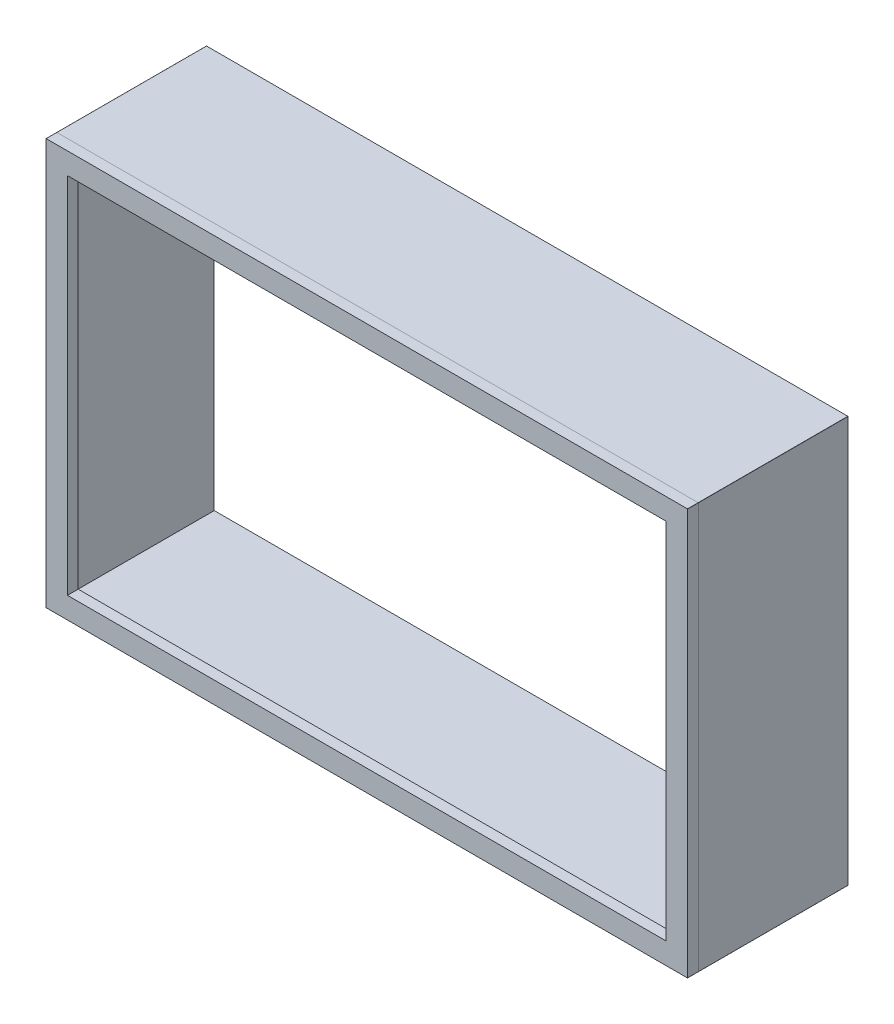
from build123d import *

# Parameters (mm, degrees)
EXTRUDE_THIN1_DEPTH      = 203.2
EXTRUDE_THIN1_DEPTH_BACK = 152.4
SKETCH1_W                = 1486.916
SKETCH1_H                = 928.116
SKETCH2_W                = 1422.4
SKETCH2_H                = 863.6
EXTRUDE_THIN2_DEPTH      = 25.4


with BuildPart() as part:
    # Sketch1 → Extrude-Thin1 (new, two sides: drawn at the far end of the back side and taken through both)
    with BuildSketch(Plane.XY.offset(-EXTRUDE_THIN1_DEPTH_BACK)):
        with BuildLine():
            Line((-761.746, 482.6), (761.746, 482.6))
            ThreePointArc((761.746, 482.6), (761.925605122, 482.525605122), (762, 482.346))
            Line((762, 482.346), (762, -482.346))
            ThreePointArc((762, -482.346), (761.925605123, -482.525605123), (761.746, -482.6))
            Line((761.746, -482.6), (-761.746, -482.6))
            ThreePointArc((-761.746, -482.6), (-761.925605122, -482.525605122), (-762, -482.346))
            Line((-762, -482.346), (-762, 482.346))
            ThreePointArc((-762, 482.346), (-761.925605122, 482.525605122), (-761.746, 482.6))
        make_face()
        Rectangle(SKETCH1_W, SKETCH1_H, mode=Mode.SUBTRACT)
    extrude(amount=EXTRUDE_THIN1_DEPTH + EXTRUDE_THIN1_DEPTH_BACK)


with BuildPart() as body_2:
    # Sketch2 → Extrude-Thin2 (new body)
    with BuildSketch(Plane.XY.offset(203.2)):
        with BuildLine():
            Line((-762, 482.346), (-762, -482.346))
            ThreePointArc((-762, -482.346), (-761.925605122, -482.525605123), (-761.746, -482.6))
            Line((-761.746, -482.6), (761.746, -482.6))
            ThreePointArc((761.746, -482.6), (761.925605122, -482.525605122), (762, -482.346))
            Line((762, -482.346), (762, 482.346))
            ThreePointArc((762, 482.346), (761.925605122, 482.525605122), (761.746, 482.6))
            Line((761.746, 482.6), (-761.746, 482.6))
            ThreePointArc((-761.746, 482.6), (-761.925605122, 482.525605122), (-762, 482.346))
        make_face()
        Rectangle(SKETCH2_W, SKETCH2_H, mode=Mode.SUBTRACT)
    extrude(amount=EXTRUDE_THIN2_DEPTH)


solid = Compound([part.part, body_2.part])
